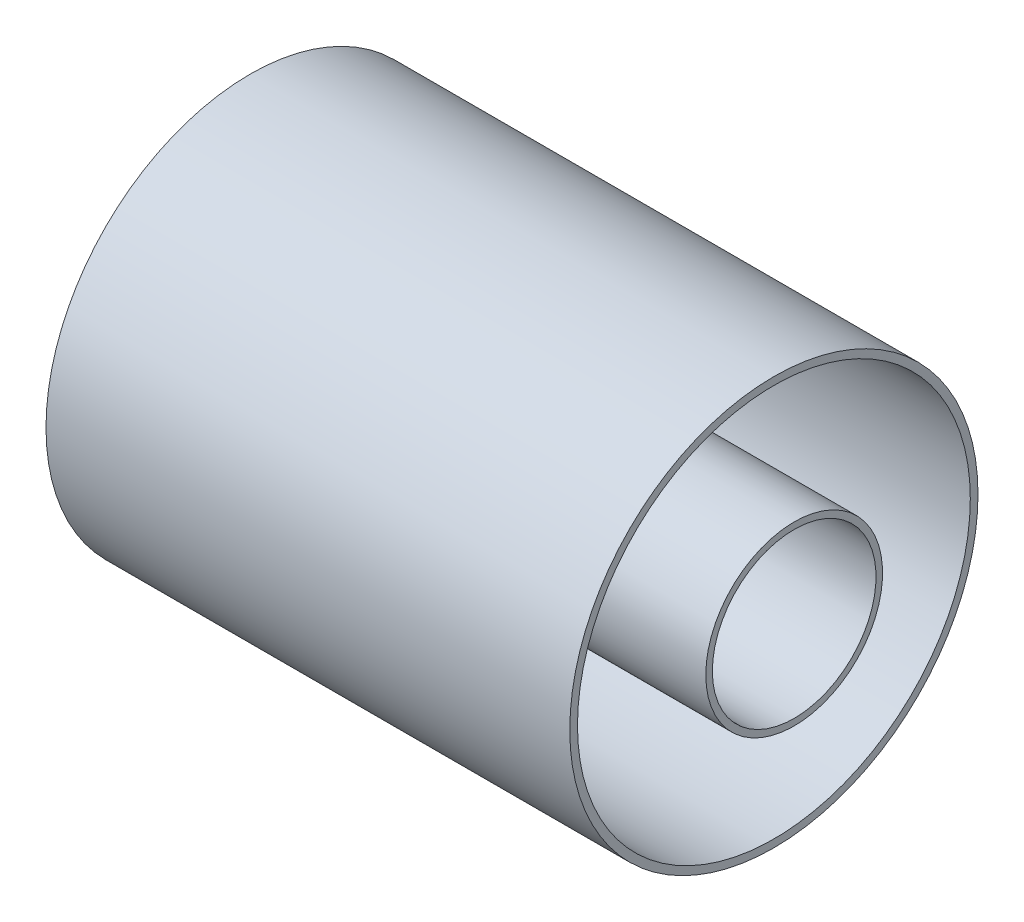
from build123d import *

# Parameters (mm, degrees)
SKETCH2_W   = 215.138
SKETCH2_H   = 2.54
SKETCH2_W_2 = 203.2
SKETCH2_H_2 = 2.9845


with BuildPart() as part:
    # Sketch2 → Revolve1 (revolve)
    with BuildSketch(Plane.XY, mode=Mode.PRIVATE) as revolve1_sk:
        with Locations((-47.415009986, 33.02)):
            Rectangle(SKETCH2_W, SKETCH2_H)
        with Locations((-49.320009986, 77.69225)):
            Rectangle(SKETCH2_W_2, SKETCH2_H_2)
    revolve(revolve1_sk.sketch.rotate(Axis((0, 0, 0), (1, 0, 0)), 90), axis=Axis((0, 0, 0), (1, 0, 0)))


solid = part.part
